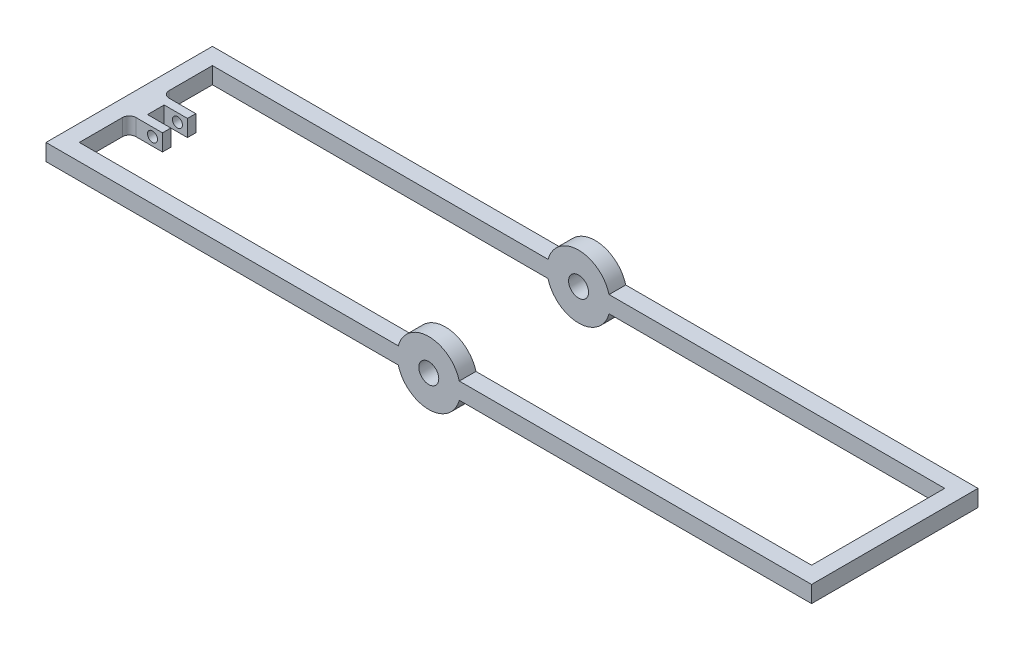
from build123d import *

# Parameters (mm, degrees)
SKETCH1_R               = 3
BOSS_EXTRUDE1_DEPTH     = 50
CUT_EXTRUDE1_DEPTH      = 236.677746086
CUT_EXTRUDE1_DEPTH_BACK = 236.677746086
SKETCH2_W               = 220
SKETCH2_H               = 40
SKETCH3_W               = 10
SKETCH3_H               = 5
BOSS_EXTRUDE2_DEPTH     = 10
CUT_EXTRUDE2_REACH      = 237.678
SKETCH4_W               = 7
SKETCH4_H               = 5
FILLET1_R               = 2
SKETCH5_R               = 1.5
CUT_EXTRUDE3_DEPTH      = 10


with BuildPart() as part:
    # Sketch1 → Boss-Extrude1 (new body)
    with BuildSketch(Plane.XY):
        with BuildLine():
            Line((124.16515139, 0), (230, 0))
            Line((230, 0), (230, 5))
            Line((230, 5), (124.16515139, 5))
            ThreePointArc((124.16515139, 5), (115, 12), (105.83484861, 5))
            Line((105.83484861, 5), (0, 5))
            Line((0, 5), (0, 0))
            Line((0, 0), (105.83484861, 0))
            ThreePointArc((105.83484861, 0), (115, -7), (124.16515139, 0))
        make_face()
        with Locations((115, 2.5)):
            Circle(SKETCH1_R, mode=Mode.SUBTRACT)
    extrude(amount=BOSS_EXTRUDE1_DEPTH)

    # Sketch2 → Cut-Extrude1 (cut, two sides: drawn at the far end of the back side and taken through both)
    with BuildSketch(Plane(origin=(0, 0, 0), x_dir=(-1, 0, 0), z_dir=(0, -1, 0)).offset(-CUT_EXTRUDE1_DEPTH_BACK)):
        with Locations((-115, -25)):
            Rectangle(SKETCH2_W, SKETCH2_H)
    extrude(amount=CUT_EXTRUDE1_DEPTH + CUT_EXTRUDE1_DEPTH_BACK, mode=Mode.SUBTRACT)

    # Sketch3 → Boss-Extrude2 (add)
    with BuildSketch(Plane(origin=(5, 0, 0), x_dir=(0, 0, -1), z_dir=(1, 0, 0))):
        with Locations((-25, 2.5)):
            Rectangle(SKETCH3_W, SKETCH3_H)
    extrude(amount=BOSS_EXTRUDE2_DEPTH)

    # Sketch4 → Cut-Extrude2 (cut, up to next)
    with BuildSketch(Plane(origin=(0, 5, 0), x_dir=(1, 0, 0), z_dir=(0, 1, 0)), mode=Mode.PRIVATE) as cut_extrude2_sk1:
        with Locations((11.5, -25)):
            Rectangle(SKETCH4_W, SKETCH4_H)
    cut_extrude2_tool1 = extrude(cut_extrude2_sk1.sketch, amount=-CUT_EXTRUDE2_REACH, mode=Mode.PRIVATE) & part.part
    add(cut_extrude2_tool1.solids().sort_by_distance((11.5, 5, 25))[0], mode=Mode.SUBTRACT)

    # Fillet1
    fillet1_edges = [part.edges().sort_by_distance(p)[0] for p in [
        (5, 2.5, 30),
        (5, 2.5, 20),
    ]]
    fillet(fillet1_edges, radius=FILLET1_R)

    # Sketch5 → Cut-Extrude3 (cut)
    with BuildSketch(Plane(origin=(0, 0, 20), x_dir=(-1, 0, 0), z_dir=(0, 0, -1))):
        with Locations((-12, 2.5)):
            Circle(SKETCH5_R)
    extrude(amount=-CUT_EXTRUDE3_DEPTH, mode=Mode.SUBTRACT)


solid = part.part
